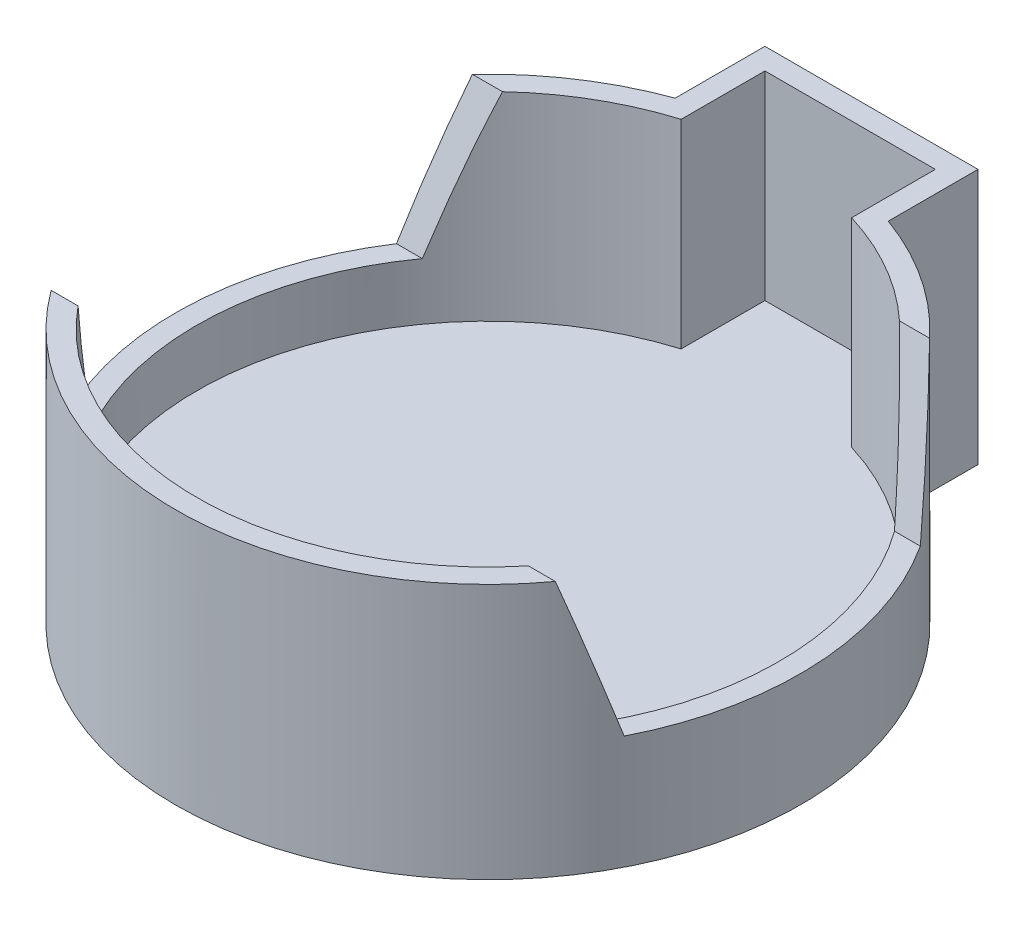
from build123d import *

# Parameters (mm, degrees)
EXTRUDE_1_DEPTH           = 9
SHELL_1_T                 = -0.75
SHELL_1_THICKNESS_2_DEPTH = 1.25
CUT_EXTRUDE_1_DEPTH       = 20.602295784
CUT_EXTRUDE_1_DEPTH_BACK  = 20.602295784


with BuildPart() as part:
    # 草图1 → 凸台-拉伸1 (new body)
    with BuildSketch(Plane(origin=(0, 0, 0), x_dir=(1, 0, 0), z_dir=(0, 1, 0))):
        with BuildLine():
            Line((-3.75, 10.34105894), (-3.75, 13.5))
            Line((-3.75, 13.5), (3.75, 13.5))
            Line((3.75, 13.5), (3.75, 10.34105894))
            ThreePointArc((3.75, 10.34105894), (0, -11), (-3.75, 10.34105894))
        make_face()
    extrude(amount=EXTRUDE_1_DEPTH)

    # 抽壳1
    shell_1_openings = [part.faces().sort_by_distance(p)[0] for p in [
        (0, 9, -0.617377205),
    ]]
    offset(amount=SHELL_1_T, openings=shell_1_openings, kind=Kind.INTERSECTION)

    # 抽壳1 thickness 2 face (on inner face of the shell) → 抽壳1 thickness 2 (add)
    with BuildSketch(Plane(origin=(0, 0.75, -0.524637331), x_dir=(0, 0, -1), z_dir=(0, -1, 0))):
        with BuildLine():
            ThreePointArc((9.276510561, -3), (-10.774637331, 0), (9.276510561, 3))
            Line((9.276510561, 3), (12.225362669, 3))
            Line((12.225362669, 3), (12.225362669, -3))
            Line((12.225362669, -3), (9.276510561, -3))
        make_face()
    extrude(amount=-SHELL_1_THICKNESS_2_DEPTH)

    # 草图2 → 切除-拉伸1 (cut, two sides: drawn at the far end of the back side and taken through both)
    with BuildSketch(Plane(origin=(0, 0, 0), x_dir=(0, 0, -1), z_dir=(1, 0, 0)).offset(-CUT_EXTRUDE_1_DEPTH_BACK)):
        Polygon((-6.5, 9), (-5, 4), (6, 4), (7.5, 9), align=None)
    extrude(amount=CUT_EXTRUDE_1_DEPTH + CUT_EXTRUDE_1_DEPTH_BACK, mode=Mode.SUBTRACT)


solid = part.part
